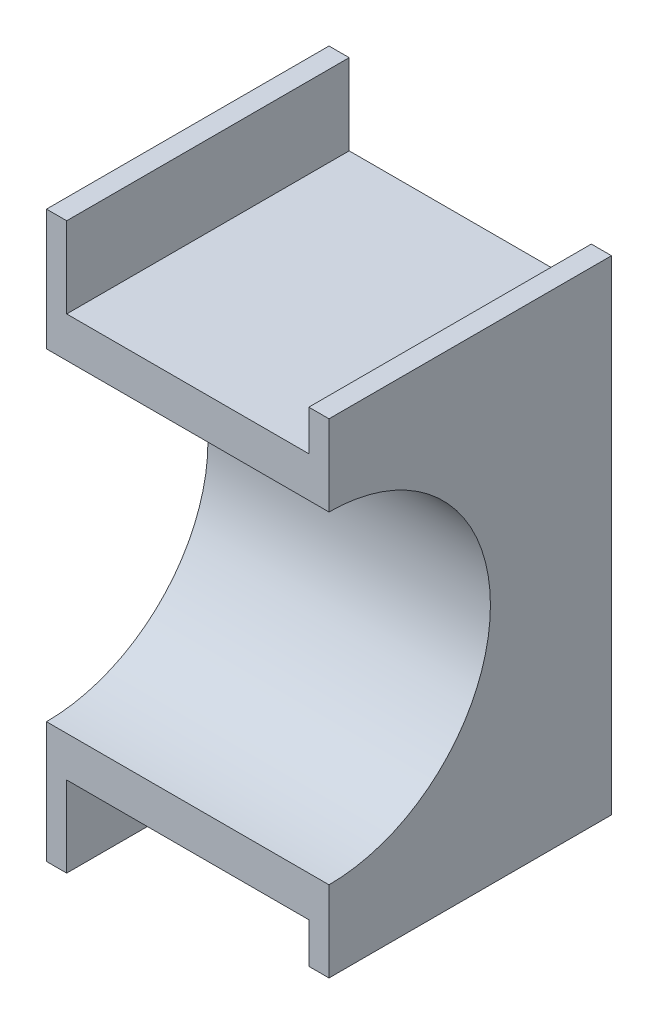
from build123d import *

# Parameters (mm, degrees)
ESQUISSE1_W             = 3.5
ESQUISSE1_H             = 7
BOSS_EXTRU_1_DEPTH      = 3.5
ESQUISSE2_W             = 3
ESQUISSE2_H             = 3.5
ENL_V_MAT_EXTRU_1_DEPTH = 1
ESQUISSE3_W             = 3
ESQUISSE3_H             = 3.5
ENL_V_MAT_EXTRU_2_DEPTH = 1
ENL_V_MAT_EXTRU_4_DEPTH = 10
ESQUISSE6_W             = 3.5
ESQUISSE6_H             = 0.5
ENL_V_MAT_EXTRU_5_DEPTH = 2


with BuildPart() as part:
    # Esquisse1 → Boss.-Extru.1 (new body)
    with BuildSketch(Plane.XY):
        with Locations((0.25, 0)):
            Rectangle(ESQUISSE1_W, ESQUISSE1_H)
    extrude(amount=BOSS_EXTRU_1_DEPTH)

    # Esquisse2 → Enlèv. mat.-Extru.1 (cut)
    with BuildSketch(Plane(origin=(0, 3.5, 0), x_dir=(1, 0, 0), z_dir=(0, 1, 0))):
        with Locations((0.25, -1.75)):
            Rectangle(ESQUISSE2_W, ESQUISSE2_H)
    extrude(amount=-ENL_V_MAT_EXTRU_1_DEPTH, mode=Mode.SUBTRACT)

    # Esquisse3 → Enlèv. mat.-Extru.2 (cut)
    with BuildSketch(Plane(origin=(0, -3.5, 0), x_dir=(-1, 0, 0), z_dir=(0, -1, 0))):
        with Locations((-0.25, -1.75)):
            Rectangle(ESQUISSE3_W, ESQUISSE3_H)
    extrude(amount=-ENL_V_MAT_EXTRU_2_DEPTH, mode=Mode.SUBTRACT)

    # Esquisse5 → Enlèv. mat.-Extru.4 (cut)
    with BuildSketch(Plane(origin=(2, 0, 0), x_dir=(0, 0, -1), z_dir=(1, 0, 0))):
        with BuildLine():
            Line((-3.5, -2), (-3.5, 2))
            ThreePointArc((-3.5, 2), (-1.5, 0), (-3.5, -2))
        make_face()
    extrude(amount=-ENL_V_MAT_EXTRU_4_DEPTH, mode=Mode.SUBTRACT)

    # Esquisse6 → Enlèv. mat.-Extru.5 (cut)
    with BuildSketch(Plane(origin=(2, 0, 0), x_dir=(0, 0, -1), z_dir=(1, 0, 0))):
        with Locations((-1.75, 3.25)):
            Rectangle(ESQUISSE6_W, ESQUISSE6_H)
        with Locations((-1.75, -3.25)):
            Rectangle(ESQUISSE6_W, ESQUISSE6_H)
    extrude(amount=-ENL_V_MAT_EXTRU_5_DEPTH, mode=Mode.SUBTRACT)


solid = part.part
